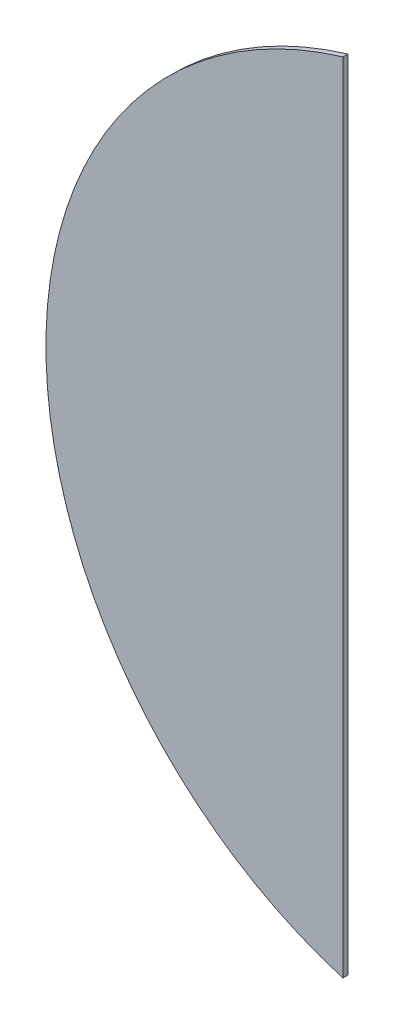
from build123d import *

# Parameters (mm, degrees)
BOSS_EXTRUDE1_DEPTH = 2


with BuildPart() as part:
    # Sketch1 → Boss-Extrude1 (new body)
    with BuildSketch(Plane.XY):
        with BuildLine():
            Line((439.464376559, 159.758895406), (439.464376559, -159.758895406))
            ThreePointArc((439.464376559, -159.758895406), (320.515085623, 0), (439.464376559, 159.758895406))
        make_face()
    extrude(amount=BOSS_EXTRUDE1_DEPTH)


solid = part.part
